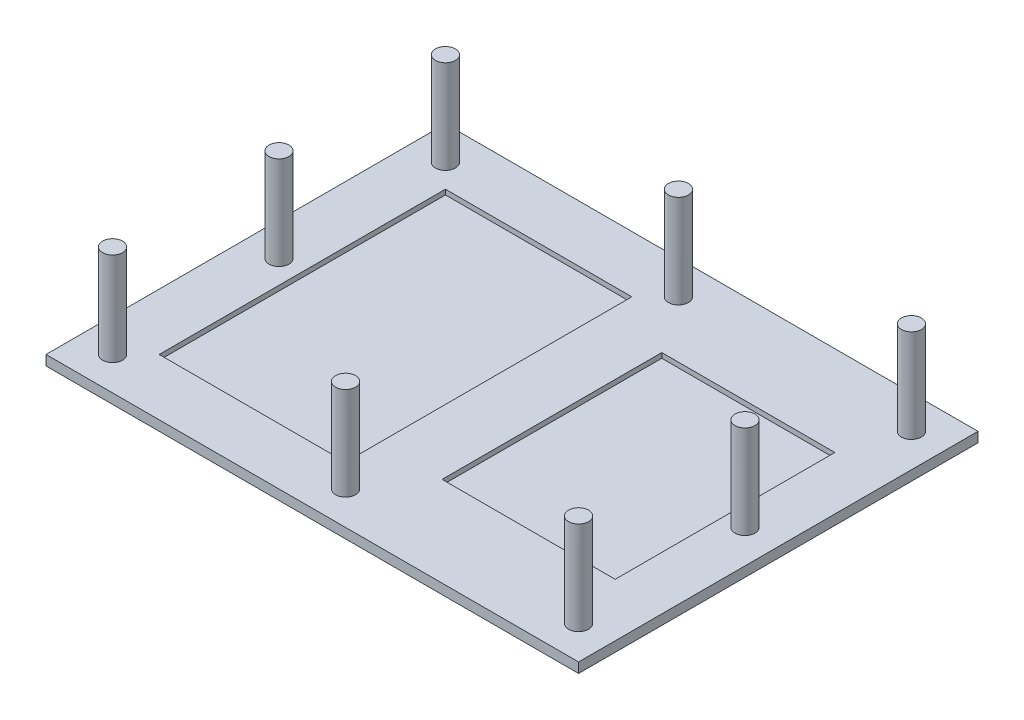
from build123d import *

# Parameters (mm, degrees)
SKETCH1_W           = 160
SKETCH1_H           = 120
BOSS_EXTRUDE1_DEPTH = 3
SKETCH2_R           = 3
BOSS_EXTRUDE2_DEPTH = 28
SKETCH3_W           = 56
SKETCH3_H           = 86
CUT_EXTRUDE1_DEPTH  = 1.5
SKETCH5_W           = 52
SKETCH5_H           = 66
CUT_EXTRUDE2_DEPTH  = 1.5


with BuildPart() as part:
    # Sketch1 → Boss-Extrude1 (new body)
    with BuildSketch(Plane(origin=(0, 0, 0), x_dir=(1, 0, 0), z_dir=(0, 1, 0))):
        Rectangle(SKETCH1_W, SKETCH1_H)
    extrude(amount=BOSS_EXTRUDE1_DEPTH)

    # Sketch2 → Boss-Extrude2 (add)
    with BuildSketch(Plane(origin=(0, 3, 0), x_dir=(1, 0, 0), z_dir=(0, 1, 0))):
        with Locations(Location((-70, 50, 0), (0, 0, 90))):
            Circle(SKETCH2_R)
        with Locations(Location((0, 50, 0), (0, 0, 90))):
            Circle(SKETCH2_R)
        with Locations(Location((70, 50, 0), (0, 0, 90))):
            Circle(SKETCH2_R)
        with Locations(Location((-70, 0, 0), (0, 0, 90))):
            Circle(SKETCH2_R)
        with Locations(Location((70, 0, 0), (0, 0, 90))):
            Circle(SKETCH2_R)
        with Locations(Location((-70, -50, 0), (0, 0, 90))):
            Circle(SKETCH2_R)
        with Locations(Location((0, -50, 0), (0, 0, 90))):
            Circle(SKETCH2_R)
        with Locations(Location((70, -50, 0), (0, 0, 90))):
            Circle(SKETCH2_R)
    extrude(amount=BOSS_EXTRUDE2_DEPTH)

    # Sketch3 → Cut-Extrude1 (cut)
    with BuildSketch(Plane(origin=(0, 3, 0), x_dir=(1, 0, 0), z_dir=(0, 1, 0))):
        with Locations((-35, 0)):
            Rectangle(SKETCH3_W, SKETCH3_H)
    extrude(amount=-CUT_EXTRUDE1_DEPTH, mode=Mode.SUBTRACT)

    # Sketch5 → Cut-Extrude2 (cut)
    with BuildSketch(Plane(origin=(0, 3, 0), x_dir=(1, 0, 0), z_dir=(0, 1, 0))):
        with Locations((38, 0)):
            Rectangle(SKETCH5_W, SKETCH5_H)
    extrude(amount=-CUT_EXTRUDE2_DEPTH, mode=Mode.SUBTRACT)


solid = part.part
